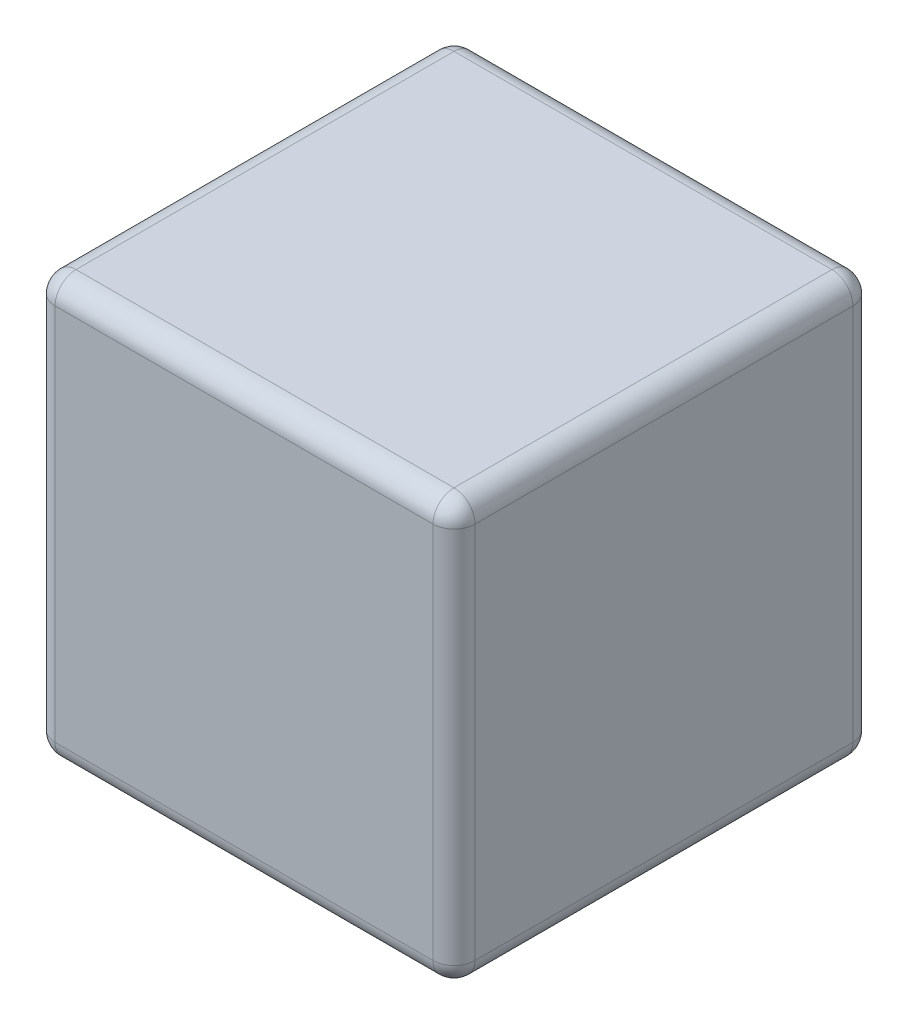
from build123d import *

# Parameters (mm, degrees)
BOSS_EXTRUDE1_DEPTH      = 5
BOSS_EXTRUDE1_DEPTH_BACK = 5
SKETCH1_W                = 10
SKETCH1_H                = 10
FILLET1_R                = 0.5


with BuildPart() as part:
    # Sketch1 → Boss-Extrude1 (new, two sides: drawn at the far end of the back side and taken through both)
    with BuildSketch(Plane(origin=(0, 0, 0), x_dir=(1, 0, 0), z_dir=(0, 1, 0)).offset(-BOSS_EXTRUDE1_DEPTH_BACK)):
        Rectangle(SKETCH1_W, SKETCH1_H)
    extrude(amount=BOSS_EXTRUDE1_DEPTH + BOSS_EXTRUDE1_DEPTH_BACK)

    # Fillet1
    fillet1_edges = [part.edges().sort_by_distance(p)[0] for p in [
        (0, -5, -5),
        (5, -5, 0),
        (5, 0, -5),
        (0, -5, 5),
        (5, 0, 5),
        (-5, -5, 0),
        (-5, 0, -5),
        (-5, 0, 5),
        (-5, 5, 0),
        (0, 5, -5),
        (5, 5, 0),
        (0, 5, 5),
    ]]
    fillet(fillet1_edges, radius=FILLET1_R)


solid = part.part
